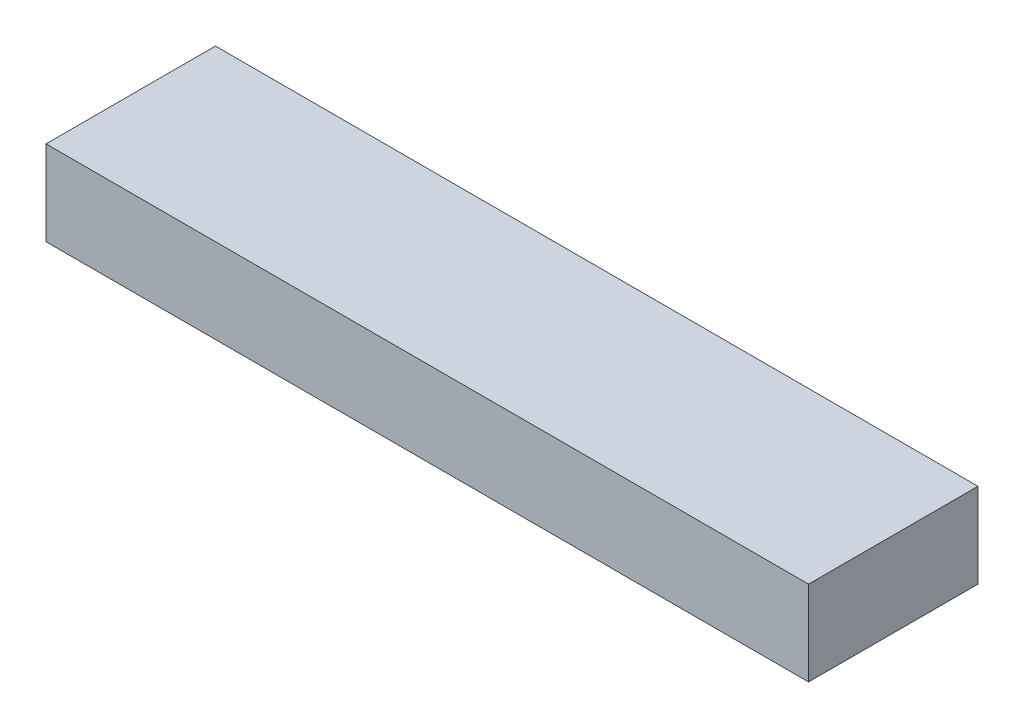
from build123d import *

# Parameters (mm, degrees)
SKETCH2_W                    = 18
SKETCH2_H                    = 4
HIROSE_CONNECTOR_STACK_DEPTH = 2


with BuildPart() as part:
    # Sketch2 → Hirose Connector Stack (new body)
    with BuildSketch(Plane(origin=(0, 0, 0), x_dir=(1, 0, 0), z_dir=(0, 1, 0))):
        with Locations((0, 14)):
            Rectangle(SKETCH2_W, SKETCH2_H)
    extrude(amount=HIROSE_CONNECTOR_STACK_DEPTH)


solid = part.part
